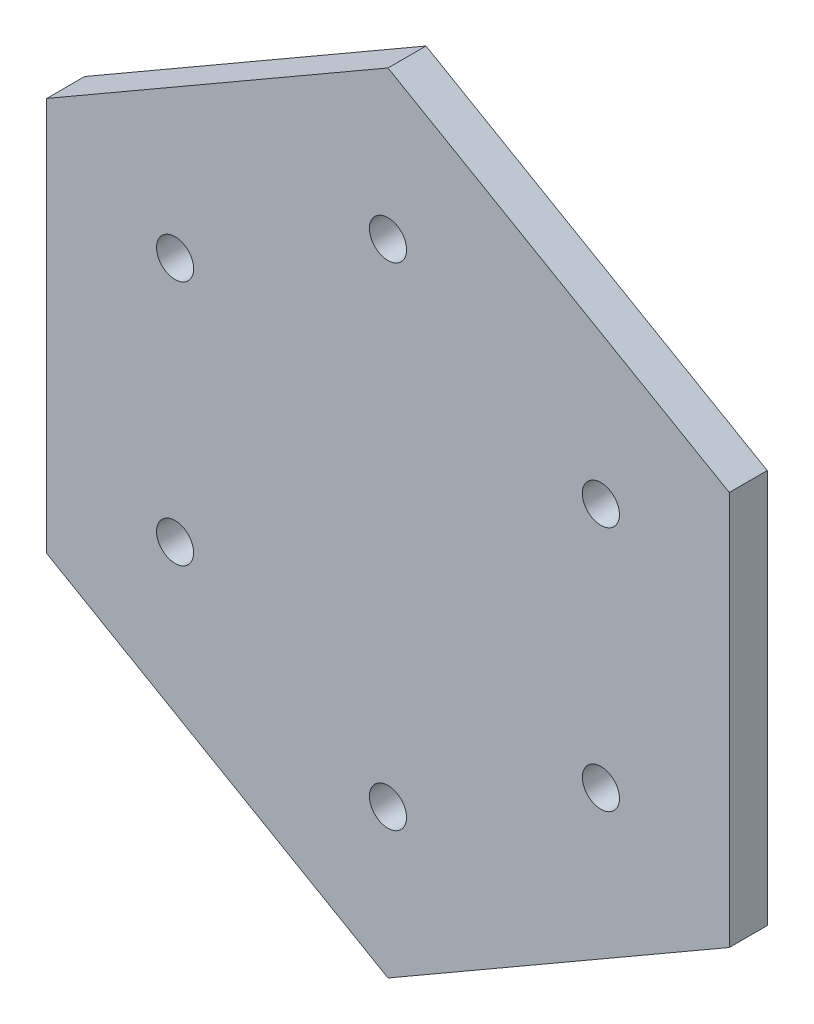
from build123d import *

# Parameters (mm, degrees)
SKETCH2_R           = 1.55
BOSS_EXTRUDE1_DEPTH = 3.175


with BuildPart() as part:
    # Sketch2 → Boss-Extrude1 (new body)
    with BuildSketch(Plane(origin=(0, 0, 0), x_dir=(0, 1, 0), z_dir=(0, 0, 1))):
        Polygon((16.454482672, -28.5), (32.908965344, 0), (16.454482672, 28.5), (-16.454482672, 28.5), (-32.908965344, 0), (-16.454482672, -28.5), align=None)
        with Locations(Location((10.26541, 17.780211681, 0), (0, 0, 270))):
            Circle(SKETCH2_R, mode=Mode.SUBTRACT)
        with Locations(Location((20.53082, 0, 0), (0, 0, 270))):
            Circle(SKETCH2_R, mode=Mode.SUBTRACT)
        with Locations(Location((10.26541, -17.780211681, 0), (0, 0, 270))):
            Circle(SKETCH2_R, mode=Mode.SUBTRACT)
        with Locations(Location((-10.26541, -17.780211681, 0), (0, 0, 270))):
            Circle(SKETCH2_R, mode=Mode.SUBTRACT)
        with Locations(Location((-20.53082, 0, 0), (0, 0, 270))):
            Circle(SKETCH2_R, mode=Mode.SUBTRACT)
        with Locations(Location((-10.26541, 17.780211681, 0), (0, 0, 270))):
            Circle(SKETCH2_R, mode=Mode.SUBTRACT)
    extrude(amount=BOSS_EXTRUDE1_DEPTH)


solid = part.part
